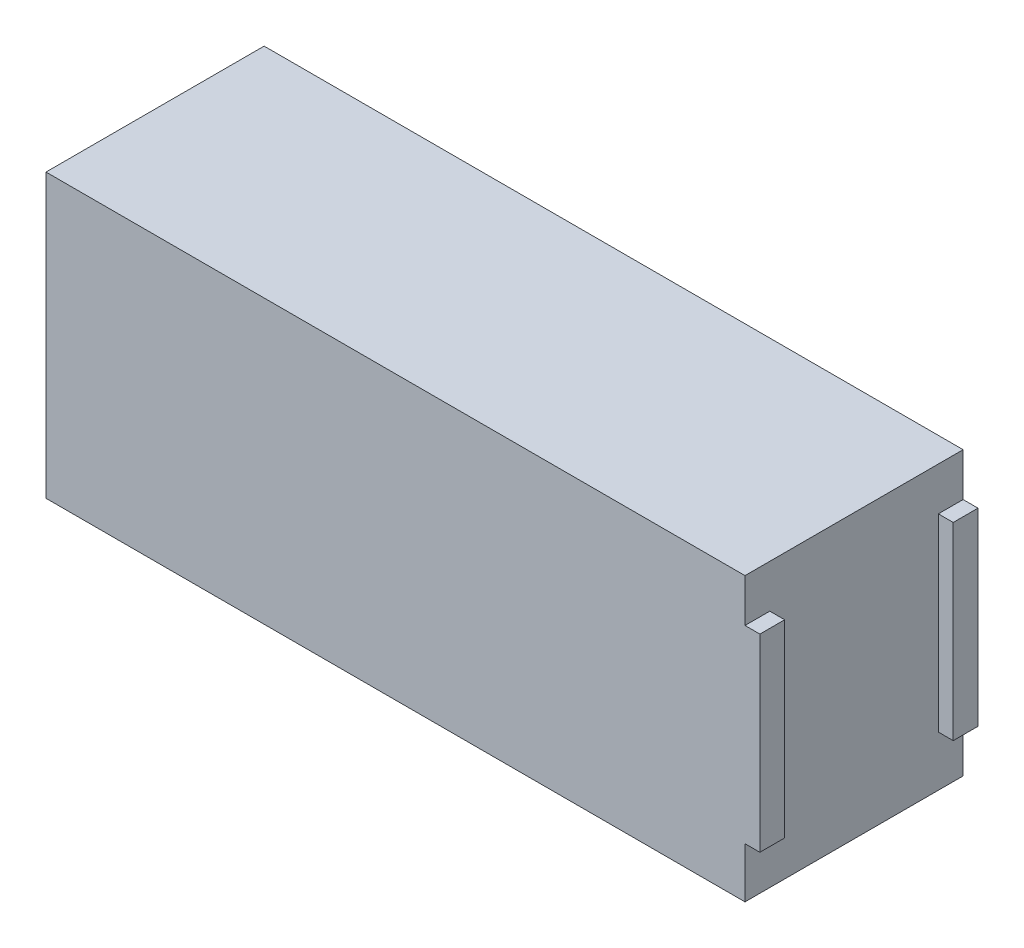
from build123d import *

# Parameters (mm, degrees)
SKETCH_1_W      = 141
SKETCH_1_H      = 44
EXTRUDE_1_DEPTH = 57
SKETCH_2_W      = 5
SKETCH_2_H      = 38.117540617
EXTRUDE_2_DEPTH = 3


with BuildPart() as part:
    # Эскиз1 → Бобышка-Вытянуть1 (new body)
    with BuildSketch(Plane(origin=(0, 0, 0), x_dir=(1, 0, 0), z_dir=(0, 1, 0))):
        with Locations((70.5, 22)):
            Rectangle(SKETCH_1_W, SKETCH_1_H)
    extrude(amount=EXTRUDE_1_DEPTH)

    # Эскиз2 → Бобышка-Вытянуть2 (add)
    with BuildSketch(Plane(origin=(141, 0, 0), x_dir=(0, 0, -1), z_dir=(1, 0, 0))):
        with Locations((2.5, 29.228604901)):
            Rectangle(SKETCH_2_W, SKETCH_2_H)
        with Locations((41.5, 29.228604901)):
            Rectangle(SKETCH_2_W, SKETCH_2_H)
    extrude(amount=EXTRUDE_2_DEPTH)


solid = part.part
